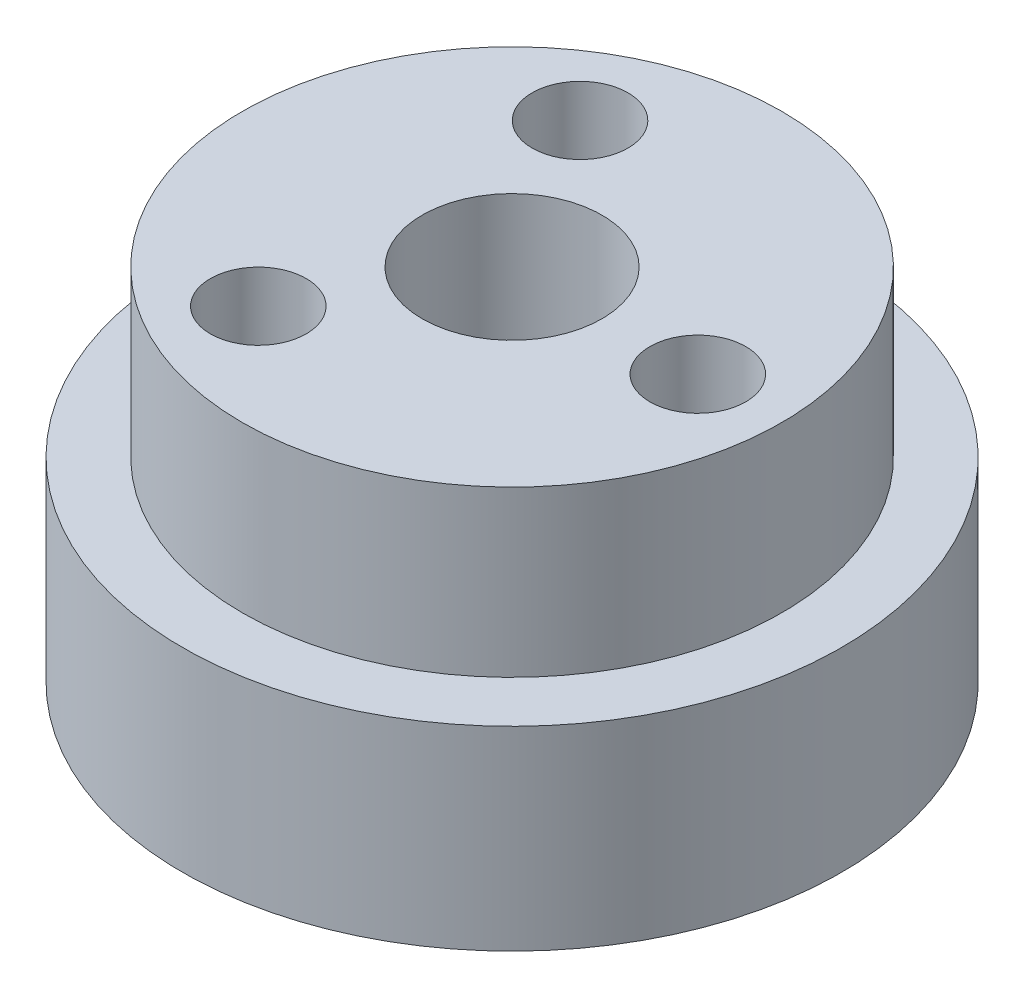
from build123d import *

# Parameters (mm, degrees)
SKETCH1_R           = 11
BOSS_EXTRUDE1_DEPTH = 6.5
SKETCH2_R           = 9
BOSS_EXTRUDE2_DEPTH = 5.5
SKETCH3_R           = 3
CUT_EXTRUDE1_DEPTH  = 15.5
SKETCH4_R           = 1.6
CUT_EXTRUDE2_DEPTH  = 15.5
CIRPATTERN1_COUNT   = 3


with BuildPart() as part:
    # Sketch1 → Boss-Extrude1 (new body)
    with BuildSketch(Plane(origin=(0, 0, 0), x_dir=(1, 0, 0), z_dir=(0, 1, 0))):
        with Locations(Location((-22.120080678, 12.823767702, 0), (0, 0, 90))):
            Circle(SKETCH1_R)
    extrude(amount=BOSS_EXTRUDE1_DEPTH)

    # Sketch2 → Boss-Extrude2 (add)
    with BuildSketch(Plane(origin=(0, 6.5, 0), x_dir=(1, 0, 0), z_dir=(0, 1, 0))):
        with Locations(Location((-22.120080678, 12.823767702, 0), (0, 0, 270))):
            Circle(SKETCH2_R)
    extrude(amount=BOSS_EXTRUDE2_DEPTH)

    # Sketch3 → Cut-Extrude1 (cut)
    with BuildSketch(Plane(origin=(0, 12, 0), x_dir=(1, 0, 0), z_dir=(0, 1, 0))):
        with Locations(Location((-22.120080678, 12.823767702, 0), (0, 0, 270))):
            Circle(SKETCH3_R)
    extrude(amount=-CUT_EXTRUDE1_DEPTH, mode=Mode.SUBTRACT)

    # Sketch4 → Cut-Extrude2 (cut)
    with BuildSketch(Plane(origin=(0, 12, 0), x_dir=(1, 0, 0), z_dir=(0, 1, 0))):
        with Locations(Location((-15.920080678, 12.823767702, 0), (0, 0, 270))):
            Circle(SKETCH4_R)
    cut_extrude2 = extrude(amount=-CUT_EXTRUDE2_DEPTH, mode=Mode.SUBTRACT)

    # CirPattern1: Cut-Extrude2 ×3 about axis
    cirpattern1_axis = Axis((-22.120080678, 0, -12.823767702), (0, 1, 0))
    for i in range(1, CIRPATTERN1_COUNT):
        add(cut_extrude2.rotate(cirpattern1_axis, i * 360 / CIRPATTERN1_COUNT), mode=Mode.SUBTRACT)


solid = part.part
